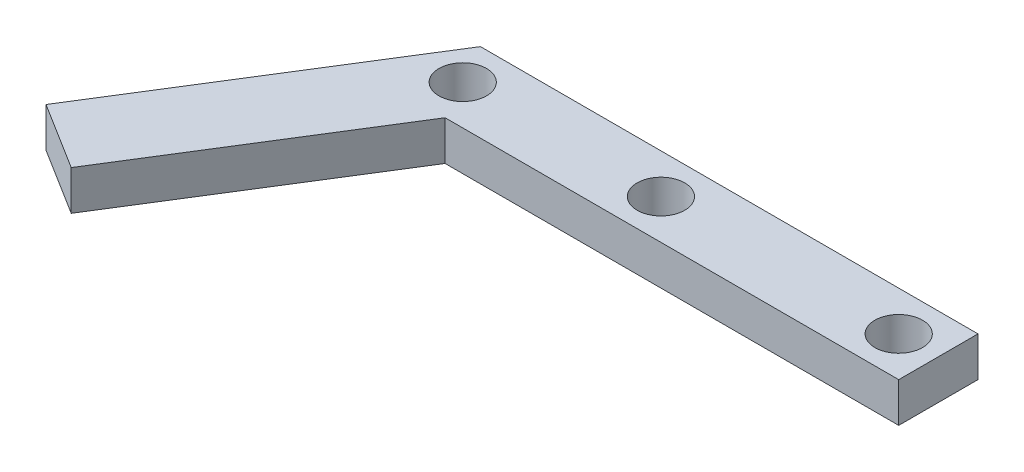
from build123d import *

# Parameters (mm, degrees)
SKETCH1_R           = 3
BOSS_EXTRUDE2_DEPTH = 2.5


with BuildPart() as part:
    # Sketch1 → Boss-Extrude2 (new, symmetric)
    with BuildSketch(Plane(origin=(0, 0, 0), x_dir=(1, 0, 0), z_dir=(0, 1, 0))):
        Polygon((1.59064416, -6.889836802), (-6.889836802, -1.59064416), (14.185871198, 32.137539077), (76.957416455, 32.137539077), (76.957416455, 22.137539077), (19.728961713, 22.137539077), align=None)
        with Locations(Location((16.957416455, 27.137539077, 0), (0, 0, 270))):
            Circle(SKETCH1_R, mode=Mode.SUBTRACT)
        with Locations(Location((71.957416455, 27.137539077, 0), (0, 0, 270))):
            Circle(SKETCH1_R, mode=Mode.SUBTRACT)
        with Locations(Location((41.957416455, 27.137539077, 0), (0, 0, 270))):
            Circle(SKETCH1_R, mode=Mode.SUBTRACT)
    extrude(amount=BOSS_EXTRUDE2_DEPTH, both=True)


solid = part.part
